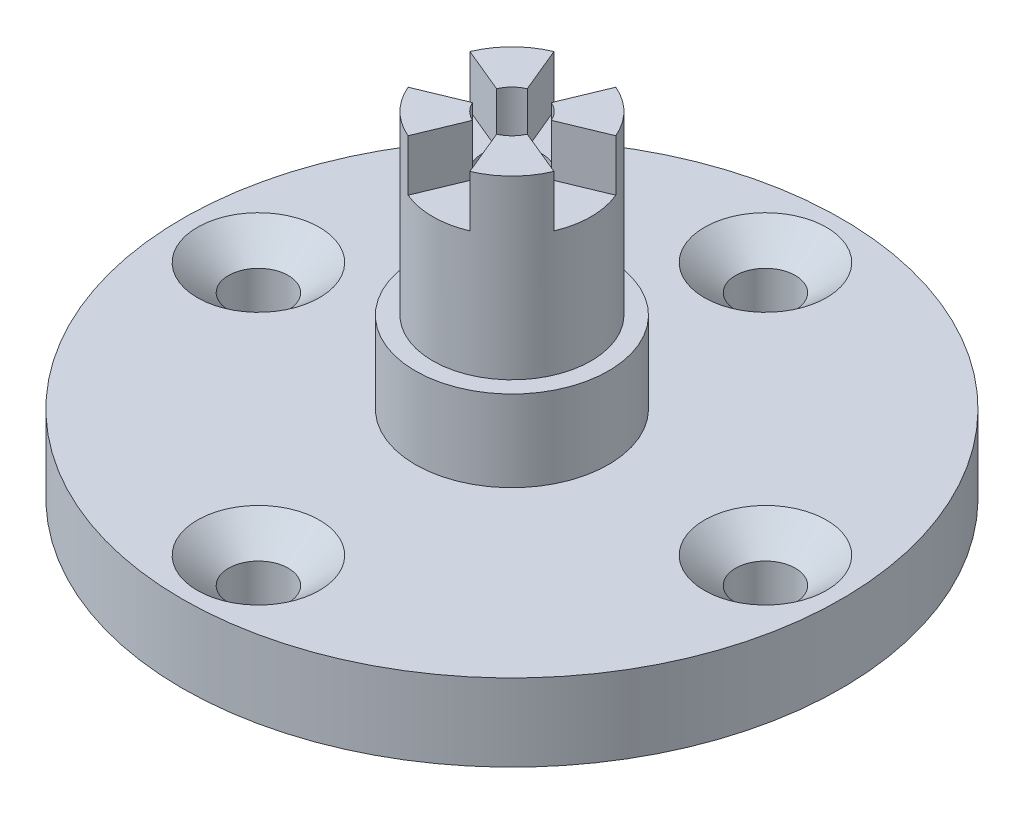
from build123d import *
from build123d.topology import SkipClean

# Parameters (mm, degrees)
SKETCH1_R                                         = 4.7625
BOSS_EXTRUDE1_DEPTH                               = 10.16
SKETCH3_R                                         = 16.25
BOSS_EXTRUDE2_DEPTH                               = 3.81
F_4_CLEARANCE_HOLE1_D                             = 2.9464
CUT_EXTRUDE1_START                                = -6.1595
SKETCH6_R                                         = 4.7625
SKETCH6_R_2                                       = 3.90525
CUT_EXTRUDE1_DEPTH                                = 6.1595
CUT_EXTRUDE4_DEPTH                                = 6.35
BOSS_EXTRUDE3_DEPTH                               = 2.54
CIRPATTERN1_COUNT                                 = 4
CSK_FOR_4_FLAT_HEAD_MACHINE_SCREW_100_D           = 2.9464
CSK_FOR_4_FLAT_HEAD_MACHINE_SCREW_100_CSINK_D     = 6.0177172
CSK_FOR_4_FLAT_HEAD_MACHINE_SCREW_100_CSINK_ANGLE = 100
CIRPATTERN2_COUNT                                 = 4


with BuildPart() as part:
    # Sketch1 → Boss-Extrude1 (new body)
    with BuildSketch(Plane(origin=(0, 0, 0), x_dir=(1, 0, 0), z_dir=(0, 1, 0))):
        with Locations(Location((0, 0, 0), (0, 0, 270))):
            Circle(SKETCH1_R)
    extrude(amount=BOSS_EXTRUDE1_DEPTH)

    # Sketch3 → Boss-Extrude2 (add)
    with BuildSketch(Plane.XZ):
        with Locations(Location((0, 0, 0), (0, 0, 90))):
            Circle(SKETCH3_R)
    extrude(amount=BOSS_EXTRUDE2_DEPTH)

    # #4 Clearance Hole1 (through all)
    with Locations(Plane(origin=(0, -3.81, 0), x_dir=(-1, 0, 0), z_dir=(0, -1, 0))):
        with Locations((0, 0)):
            Hole(F_4_CLEARANCE_HOLE1_D / 2)

    # Sketch6 → Cut-Extrude1 (cut)
    with BuildSketch(Plane(origin=(0, 10.16, 0), x_dir=(1, 0, 0), z_dir=(0, 1, 0)).offset(CUT_EXTRUDE1_START)):
        with Locations(Location((0, 0, 0), (0, 0, 270))):
            Circle(SKETCH6_R)
        with Locations(Location((0, 0, 0), (0, 0, 270))):
            Circle(SKETCH6_R_2, mode=Mode.SUBTRACT)
    extrude(amount=CUT_EXTRUDE1_DEPTH, mode=Mode.SUBTRACT)

    # Sketch7 → Cut-Extrude4 (cut)
    with BuildSketch(Plane.XZ.offset(3.81)):
        Polygon((-3.666174209, 0), (-1.833087105, -3.175), (1.833087105, -3.175), (3.666174209, 0), (1.833087105, 3.175), (-1.833087105, 3.175), align=None)
    extrude(amount=-CUT_EXTRUDE4_DEPTH, mode=Mode.SUBTRACT)

    # Sketch8 → Boss-Extrude3 (add)
    with BuildSketch(Plane(origin=(0, 10.16, 0), x_dir=(1, 0, 0), z_dir=(0, 1, 0))):
        with BuildLine():
            Line((-0.592971464, 1.348593001), (-1.523758258, 3.595711103))
            ThreePointArc((-1.523758258, 3.595711103), (-2.761428757, 2.761428757), (-3.595711103, 1.523758258))
            Line((-3.595711103, 1.523758258), (-1.348593001, 0.592971464))
            ThreePointArc((-1.348593001, 0.592971464), (-1.04170971, 1.04170971), (-0.592971464, 1.348593001))
        make_face()
    boss_extrude3 = extrude(amount=BOSS_EXTRUDE3_DEPTH)

    # CirPattern1: Boss-Extrude3 ×4 about axis
    with SkipClean():  # the faces are left unmerged after this step: merging them gives an invalid solid
        cirpattern1_axis = Axis((0, 0, 0), (0, 1, 0))
        for i in range(1, CIRPATTERN1_COUNT):
            add(boss_extrude3.rotate(cirpattern1_axis, i * 360 / CIRPATTERN1_COUNT))

    # CSK for #4 Flat Head Machine Screw (100)1 (through all)
    with Locations(Plane(origin=(0, 0, 0), x_dir=(1, 0, 0), z_dir=(0, 1, 0))):
        with Locations((0, 12.5)):
            csk_for_4_flat_head_machine_screw_100 = CounterSinkHole(CSK_FOR_4_FLAT_HEAD_MACHINE_SCREW_100_D / 2, CSK_FOR_4_FLAT_HEAD_MACHINE_SCREW_100_CSINK_D / 2, counter_sink_angle=CSK_FOR_4_FLAT_HEAD_MACHINE_SCREW_100_CSINK_ANGLE)

    # CirPattern2: CSK for #4 Flat Head Machine Screw (100)1 ×4 about axis
    with SkipClean():  # the faces are left unmerged after this step: merging them gives an invalid solid
        cirpattern2_axis = Axis((0, 0, 0), (0, 1, 0))
        for i in range(1, CIRPATTERN2_COUNT):
            add(csk_for_4_flat_head_machine_screw_100.rotate(cirpattern2_axis, i * 360 / CIRPATTERN2_COUNT), mode=Mode.SUBTRACT)


solid = part.part
